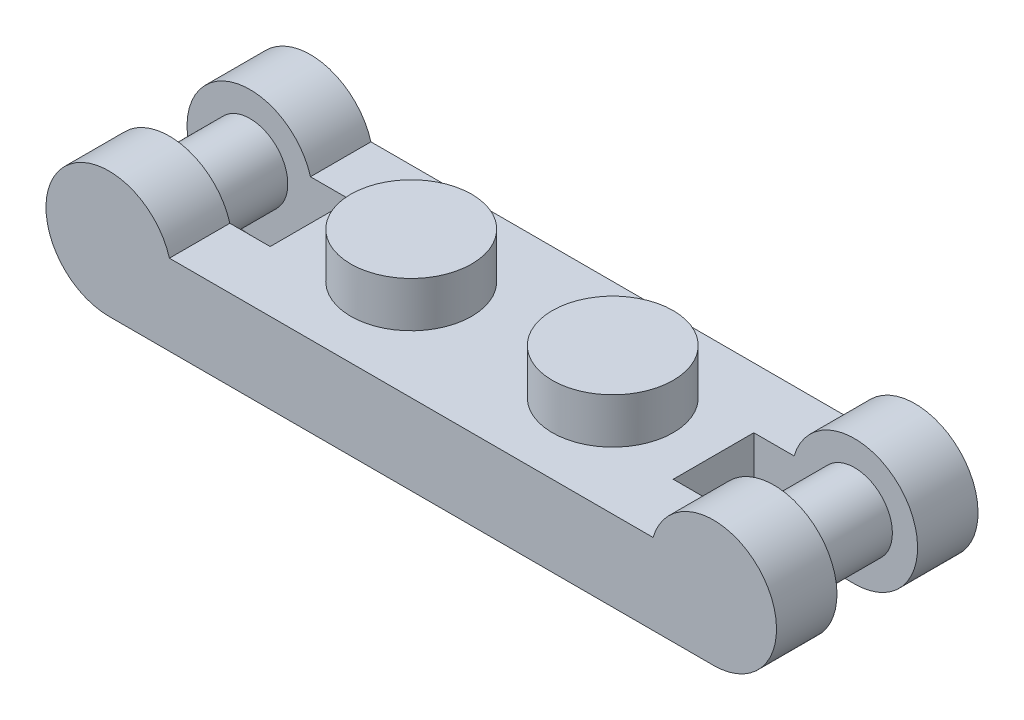
from build123d import *

# Parameters (mm, degrees)
BOSS_EXTRUDE1_DEPTH = 2.4
SKETCH2_R           = 1.5
BOSS_EXTRUDE2_DEPTH = 1.6
SKETCH3_W           = 8
SKETCH3_H           = 3.2
BOSS_EXTRUDE3_DEPTH = 1.6
SKETCH4_R           = 2.4
BOSS_EXTRUDE4_DEPTH = 1.8
SKETCH5_W           = 12.8
SKETCH5_H           = 4.8
CUT_EXTRUDE1_DEPTH  = 1.8
SKETCH6_R           = 1.6
BOSS_EXTRUDE5_DEPTH = 1.8


with BuildPart() as part:
    # Sketch1 → Boss-Extrude1 (new body)
    with BuildSketch(Plane.XY):
        with BuildLine():
            Line((9.6, 3.2), (0, 3.2))
            Line((0, 3.2), (0, 0))
            Line((0, 0), (12, 0))
            ThreePointArc((12, 0), (14, 4), (9.6, 3.2))
        make_face()
    extrude(amount=BOSS_EXTRUDE1_DEPTH)

    # Sketch2 → Boss-Extrude2 (add)
    with BuildSketch(Plane.XY.offset(2.4)):
        with Locations((12, 2.5)):
            Circle(SKETCH2_R)
    extrude(amount=BOSS_EXTRUDE2_DEPTH)

    # Sketch3 → Boss-Extrude3 (add)
    with BuildSketch(Plane.XY.offset(2.4)):
        with Locations((4, 1.6)):
            Rectangle(SKETCH3_W, SKETCH3_H)
    extrude(amount=BOSS_EXTRUDE3_DEPTH)

    # Mirror2: part across plane


with BuildPart() as part_1:
    add(part.part)
    add(part.part.mirror(Plane(origin=(12, 2.5, 4), x_dir=(1, 0, 0), z_dir=(0, 0, 1))))

    # Mirror3: part across plane


with BuildPart() as part_2:
    add(part_1.part)
    add(part_1.part.mirror(Plane(origin=(0, 3.2, 2.4), x_dir=(0, 0, 1), z_dir=(1, 0, 0))))

    # Sketch4 → Boss-Extrude4 (add)
    with BuildSketch(Plane(origin=(0, 3.2, 0), x_dir=(1, 0, 0), z_dir=(0, 1, 0))):
        with Locations((-4, -4)):
            Circle(SKETCH4_R)
        with Locations((4, -4)):
            Circle(SKETCH4_R)
    extrude(amount=BOSS_EXTRUDE4_DEPTH)

    # Sketch5 → Cut-Extrude1 (cut)
    with BuildSketch(Plane.XZ):
        with Locations((0, 4)):
            Rectangle(SKETCH5_W, SKETCH5_H)
    extrude(amount=-CUT_EXTRUDE1_DEPTH, mode=Mode.SUBTRACT)

    # Sketch6 → Boss-Extrude5 (add)
    with BuildSketch(Plane.XZ.offset(-1.8)):
        with Locations((0, 4)):
            Circle(SKETCH6_R)
    extrude(amount=BOSS_EXTRUDE5_DEPTH)


solid = part_2.part
